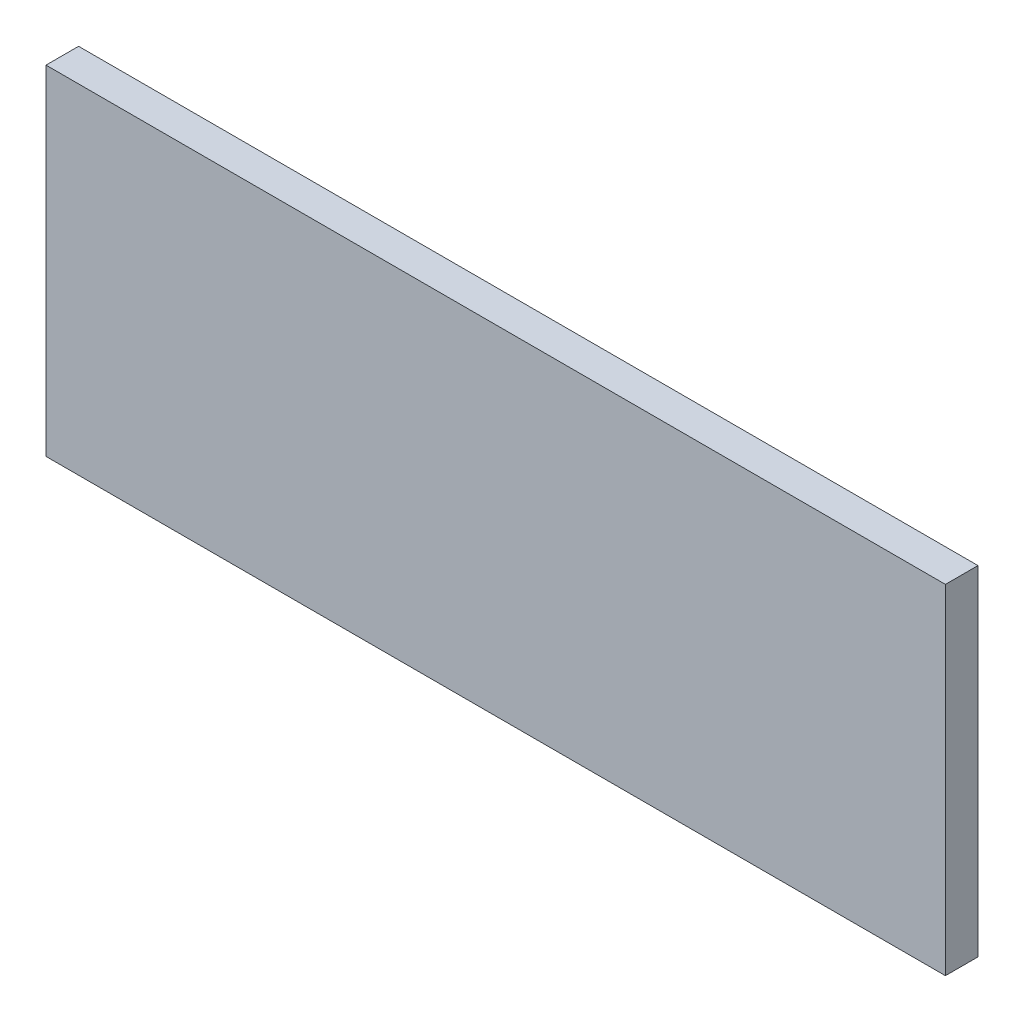
from build123d import *

# Parameters (mm, degrees)
SKETCH_1_W      = 276
SKETCH_1_H      = 104
EXTRUDE_1_DEPTH = 5


with BuildPart() as part:
    # Эскиз1 → Бобышка-Вытянуть1 (new, symmetric)
    with BuildSketch(Plane.XY):
        Rectangle(SKETCH_1_W, SKETCH_1_H)
    extrude(amount=EXTRUDE_1_DEPTH, both=True)


solid = part.part
